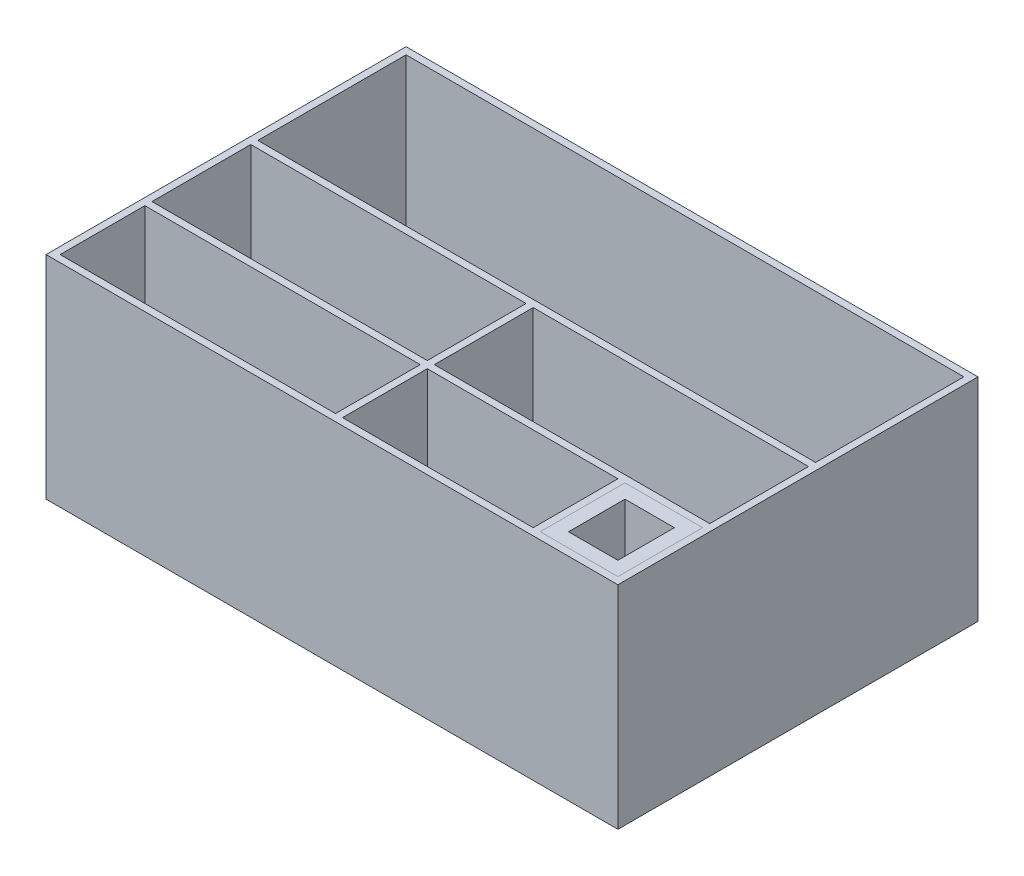
from build123d import *

# Parameters (mm, degrees)
SKETCH_1_W         = 810
SKETCH_1_H         = 510
SKETCH_1_W_2       = 790
SKETCH_1_H_2       = 210
SKETCH_1_W_3       = 390
SKETCH_1_H_3       = 120
SKETCH_1_H_4       = 140
SKETCH_1_W_4       = 270
SKETCH_1_W_5       = 110
EXTRUDE_772_DEPTH  = 300
SKETCH_3_W         = 110
SKETCH_3_H         = 120
SKETCH_3_W_2       = 70
SKETCH_3_H_2       = 80
EXTRUDE_1059_DEPTH = 300


with BuildPart() as part:
    # 草图1 → Extrude 772 (new body)
    with BuildSketch(Plane(origin=(0, 0, 0), x_dir=(1, 0, 0), z_dir=(0, 1, 0))):
        with Locations((405, 255)):
            Rectangle(SKETCH_1_W, SKETCH_1_H)
        with Locations((405, 395)):
            Rectangle(SKETCH_1_W_2, SKETCH_1_H_2, mode=Mode.SUBTRACT)
        with Locations((205, 70)):
            Rectangle(SKETCH_1_W_3, SKETCH_1_H_3, mode=Mode.SUBTRACT)
        with Locations((205, 210)):
            Rectangle(SKETCH_1_W_3, SKETCH_1_H_4, mode=Mode.SUBTRACT)
        with Locations((605, 210)):
            Rectangle(SKETCH_1_W_3, SKETCH_1_H_4, mode=Mode.SUBTRACT)
        with Locations((545, 70)):
            Rectangle(SKETCH_1_W_4, SKETCH_1_H_3, mode=Mode.SUBTRACT)
        with Locations((745, 70)):
            Rectangle(SKETCH_1_W_5, SKETCH_1_H_3, mode=Mode.SUBTRACT)
    extrude(amount=EXTRUDE_772_DEPTH)


with BuildPart() as body_2:
    # 草图3 → Extrude 1059 (new body)
    with BuildSketch(Plane(origin=(0, 0, 0), x_dir=(1, 0, 0), z_dir=(0, 1, 0))):
        with Locations((745, 70)):
            Rectangle(SKETCH_3_W, SKETCH_3_H)
        with Locations((745, 70)):
            Rectangle(SKETCH_3_W_2, SKETCH_3_H_2, mode=Mode.SUBTRACT)
    extrude(amount=EXTRUDE_1059_DEPTH)


solid = Compound([part.part, body_2.part])
